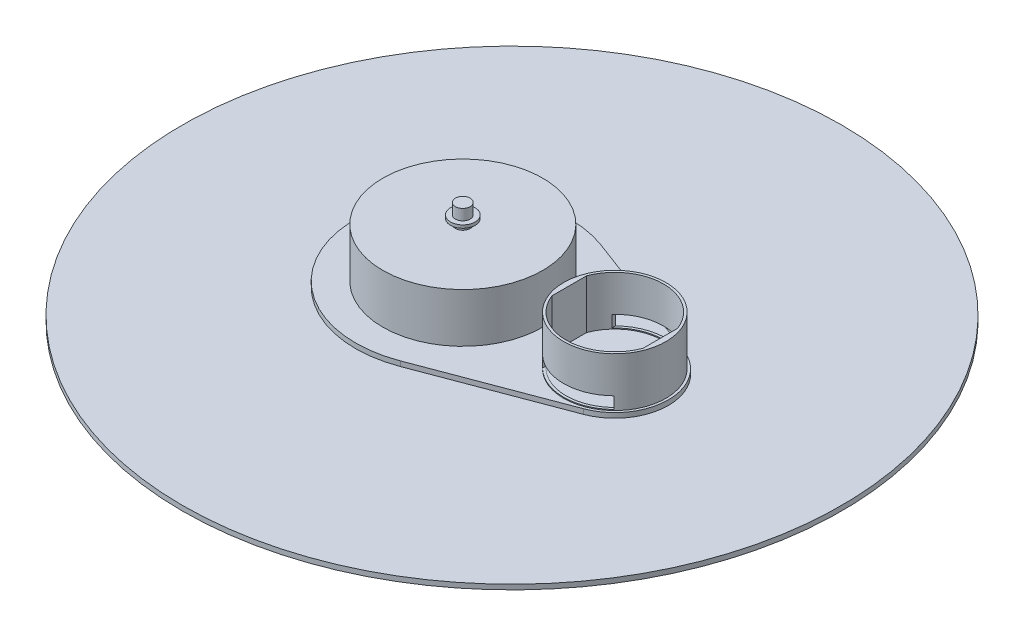
from build123d import *

# Parameters (mm, degrees)
EXTRUDE_1_DEPTH          = 5
SKETCH_2_R               = 52
EXTRUDE_2_DEPTH          = 50
SKETCH_3_R               = 7.5
EXTRUDE_3_DEPTH          = 55.3
SKETCH_4_R               = 12.5
EXTRUDE_4_DEPTH          = 3
SKETCH_5_R               = 7.5
EXTRUDE_5_DEPTH          = 11
SKETCH_6_R               = 81.275582603
EXTRUDE_6_DEPTH          = 50
SKETCH_7_R               = 335
EXTRUDE_7_DEPTH          = 5
CUT_EXTRUDE_1_DEPTH      = 632.922060068
CUT_EXTRUDE_1_DEPTH_BACK = 632.922060068
SKETCH_8_W               = 72.819825202
SKETCH_8_H               = 12


with BuildPart() as part:
    # 草图1 → 凸台-拉伸1 (new body)
    with BuildSketch(Plane(origin=(0, 0, 0), x_dir=(1, 0, 0), z_dir=(0, 1, 0))):
        with BuildLine():
            Line((282.724919094, 50.996592885), (147.449838188, 101.993185769))
            ThreePointArc((147.449838188, 101.993185769), (0, 0), (147.449838188, -101.993185769))
            Line((147.449838188, -101.993185769), (282.724919094, -50.996592885))
            ThreePointArc((282.724919094, -50.996592885), (318, 0), (282.724919094, 50.996592885))
        make_face()
    extrude(amount=EXTRUDE_1_DEPTH)

    # 草图2 → 凸台-拉伸2 (add)
    with BuildSketch(Plane(origin=(0, 5, 0), x_dir=(1, 0, 0), z_dir=(0, 1, 0))):
        with Locations(Location((263.5, 0, 0), (0, 0, 270))):
            Circle(SKETCH_2_R)
        with BuildLine():
            Line((217.25, 17.640507362), (217.25, -17.640507362))
            ThreePointArc((217.25, -17.640507362), (263.5, -49.5), (309.75, -17.640507362))
            Line((309.75, -17.640507362), (309.75, 17.640507362))
            ThreePointArc((309.75, 17.640507362), (263.5, 49.5), (217.25, 17.640507362))
        make_face(mode=Mode.SUBTRACT)
    extrude(amount=EXTRUDE_2_DEPTH)

    # 草图3 → 凸台-拉伸3 (add)
    with BuildSketch(Plane(origin=(0, 5, 0), x_dir=(1, 0, 0), z_dir=(0, 1, 0))):
        with Locations(Location((109, 0, 0), (0, 0, 270))):
            Circle(SKETCH_3_R)
    extrude(amount=EXTRUDE_3_DEPTH)

    # 草图4 → 凸台-拉伸4 (add)
    with BuildSketch(Plane(origin=(0, 60.3, 0), x_dir=(1, 0, 0), z_dir=(0, 1, 0))):
        with Locations(Location((109, 0, 0), (0, 0, 270))):
            Circle(SKETCH_4_R)
    extrude(amount=EXTRUDE_4_DEPTH)

    # 草图5 → 凸台-拉伸5 (add)
    with BuildSketch(Plane(origin=(0, 63.3, 0), x_dir=(1, 0, 0), z_dir=(0, 1, 0))):
        with Locations(Location((109, 0, 0), (0, 0, 270))):
            Circle(SKETCH_5_R)
    extrude(amount=EXTRUDE_5_DEPTH)

    # 草图6 → 凸台-拉伸6 (add)
    with BuildSketch(Plane(origin=(0, 5, 0), x_dir=(1, 0, 0), z_dir=(0, 1, 0))):
        with Locations(Location((109, 0, 0), (0, 0, 270))):
            Circle(SKETCH_6_R)
    extrude(amount=EXTRUDE_6_DEPTH)

    # 草图7 → 凸台-拉伸7 (add)
    with BuildSketch(Plane(origin=(0, 0, 0), x_dir=(-1, 0, 0), z_dir=(0, -1, 0))):
        with Locations(Location((-159, 0, 0), (0, 0, 90))):
            Circle(SKETCH_7_R)
    extrude(amount=EXTRUDE_7_DEPTH)

    # 草图8 → 切除-拉伸1 (cut, two sides: drawn at the far end of the back side and taken through both)
    with BuildSketch(Plane.XY.offset(52).offset(-CUT_EXTRUDE_1_DEPTH_BACK)):
        with Locations((263.5, 12)):
            Rectangle(SKETCH_8_W, SKETCH_8_H)
    extrude(amount=CUT_EXTRUDE_1_DEPTH + CUT_EXTRUDE_1_DEPTH_BACK, mode=Mode.SUBTRACT)


solid = part.part
